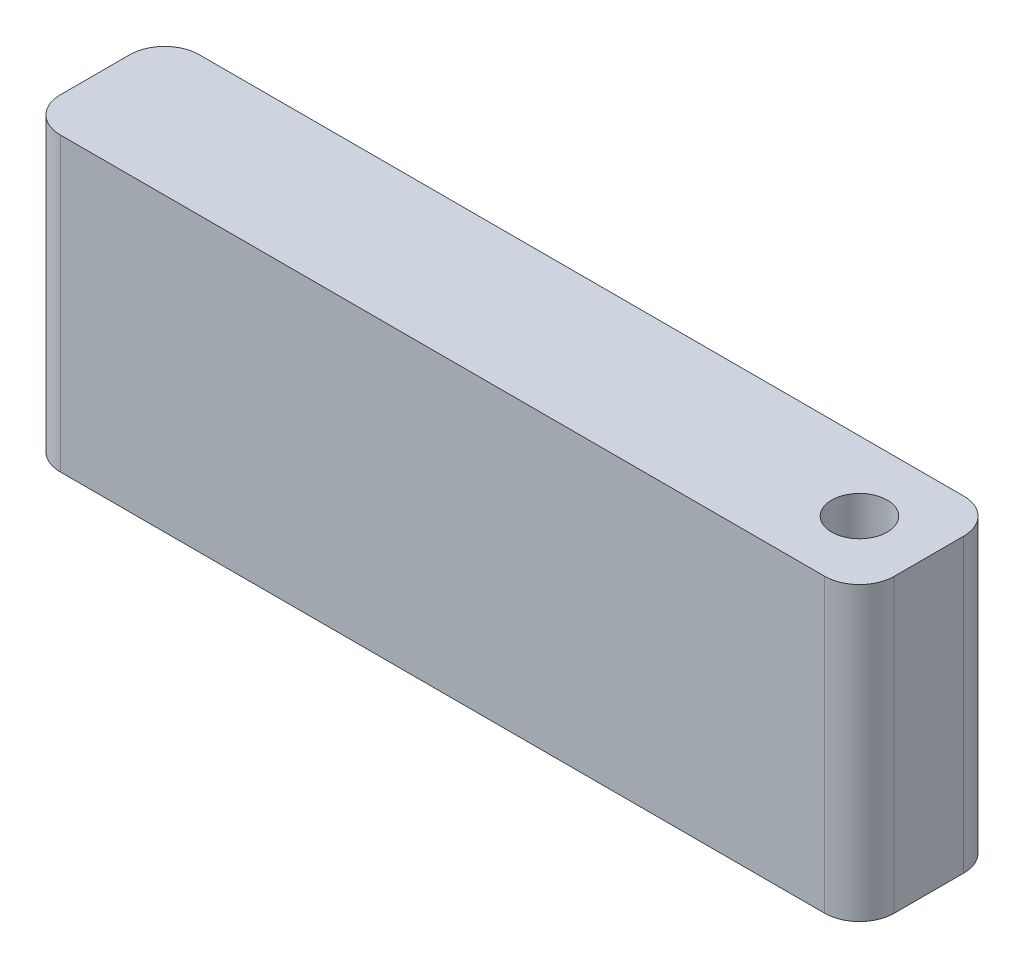
from build123d import *

# Parameters (mm, degrees)
SKETCH_1_R      = 4
EXTRUDE_1_DEPTH = 21


with BuildPart() as part:
    # 草图1 → 凸台-拉伸1 (new, symmetric)
    with BuildSketch(Plane(origin=(0, 0, 0), x_dir=(1, 0, 0), z_dir=(0, 1, 0))):
        with BuildLine():
            Line((-55, 10), (55, 10))
            ThreePointArc((55, 10), (58.535533906, 8.535533906), (60, 5))
            Line((60, 5), (60, -5))
            ThreePointArc((60, -5), (58.535533906, -8.535533906), (55, -10))
            Line((55, -10), (-55, -10))
            ThreePointArc((-55, -10), (-58.535533906, -8.535533906), (-60, -5))
            Line((-60, -5), (-60, 5))
            ThreePointArc((-60, 5), (-58.535533906, 8.535533906), (-55, 10))
        make_face()
        with Locations(Location((50, 0, 0), (0, 0, 90))):
            Circle(SKETCH_1_R, mode=Mode.SUBTRACT)
    extrude(amount=EXTRUDE_1_DEPTH, both=True)


solid = part.part
